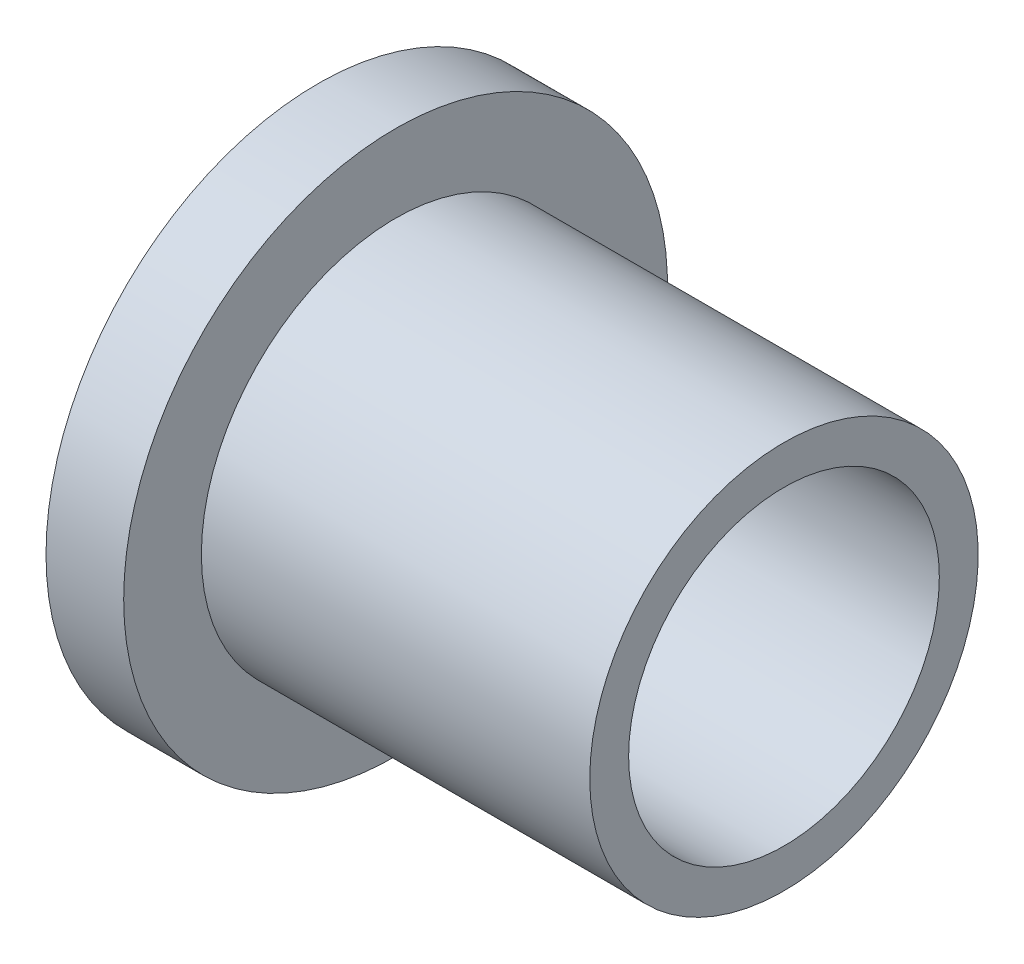
from build123d import *

# Parameters (mm, degrees)
SKETCH1_R           = 7.9375
SKETCH1_R_2         = 6.35
BOSS_EXTRUDE1_DEPTH = 19.05
SKETCH2_R           = 11.1125
SKETCH2_R_2         = 7.9375
BOSS_EXTRUDE2_DEPTH = 3.175


with BuildPart() as part:
    # Sketch1 → Boss-Extrude1 (new body)
    with BuildSketch(Plane(origin=(0, 0, 0), x_dir=(0, 0, -1), z_dir=(1, 0, 0))):
        with Locations(Location((0, 0, 0), (0, 0, 180))):
            Circle(SKETCH1_R)
        with Locations(Location((0, 0, 0), (0, 0, 180))):
            Circle(SKETCH1_R_2, mode=Mode.SUBTRACT)
    extrude(amount=BOSS_EXTRUDE1_DEPTH)

    # Sketch2 → Boss-Extrude2 (add)
    with BuildSketch(Plane.ZY):
        Circle(SKETCH2_R)
        Circle(SKETCH2_R_2, mode=Mode.SUBTRACT)
    extrude(amount=-BOSS_EXTRUDE2_DEPTH)


solid = part.part
